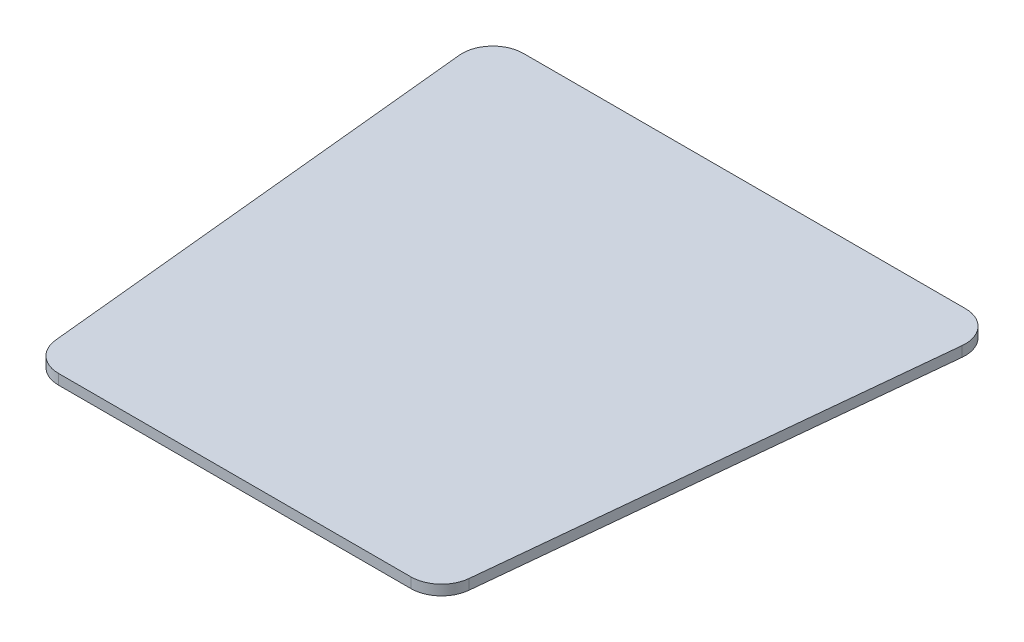
from build123d import *

# Parameters (mm, degrees)
BOSS_EXTRUDE1_DEPTH = 2
FILLET1_R           = 6


with BuildPart() as part:
    # Sketch1 → Boss-Extrude1 (new body)
    with BuildSketch(Plane(origin=(0, 0, 0), x_dir=(1, 0, 0), z_dir=(0, 1, 0))):
        Polygon((40, -50), (50, 50), (40, 50), (-40, 50), (-50, 50), (-40, -50), align=None)
    extrude(amount=BOSS_EXTRUDE1_DEPTH)

    # Fillet1
    fillet1_edges = [part.edges().sort_by_distance(p)[0] for p in [
        (-50, 1, -50),
        (50, 1, -50),
        (40, 1, 50),
        (-40, 1, 50),
    ]]
    fillet(fillet1_edges, radius=FILLET1_R)


solid = part.part
